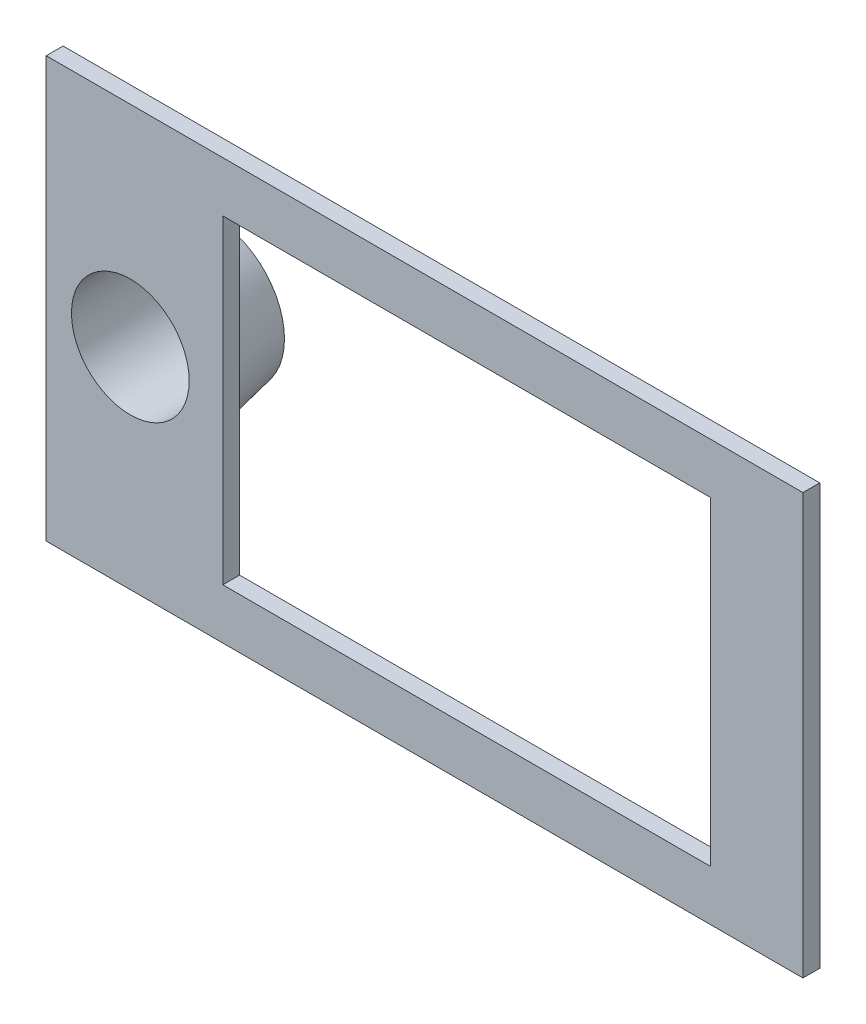
from build123d import *

# Parameters (mm, degrees)
SKETCH_1_W          = 135
SKETCH_1_H          = 75
SKETCH_1_R          = 10.5
SKETCH_1_W_2        = 87
SKETCH_1_H_2        = 57
EXTRUDE_1_DEPTH     = 3
SKETCH_5_R          = 15
SKETCH_4_R          = 12.5
CUT_EXTRUDE_1_REACH = 171.52
SKETCH_5_93_R       = 10.5


with BuildPart() as part:
    # 草图1 → 凸台-拉伸1 (new body)
    with BuildSketch(Plane(origin=(0, 0, 902.944534426), x_dir=(-1, 0, 0), z_dir=(0, 0, -1))):
        with Locations((-85.5, 34.5)):
            Rectangle(SKETCH_1_W, SKETCH_1_H)
        with Locations((-33, 34.5)):
            Circle(SKETCH_1_R, mode=Mode.SUBTRACT)
        with Locations((-93, 34.5)):
            Rectangle(SKETCH_1_W_2, SKETCH_1_H_2, mode=Mode.SUBTRACT)
    extrude(amount=EXTRUDE_1_DEPTH)

    # 草图5 → 放样4 section 0
    with BuildSketch(Plane(origin=(0, 0, 899.944534426), x_dir=(-1, 0, 0), z_dir=(0, 0, -1))):
        with Locations((-33, 34.5)):
            Circle(SKETCH_5_R)
    # 草图4 → 放样4 section 1
    with BuildSketch(Plane.XY.offset(887.944534426)):
        with Locations((33, 34.5)):
            Circle(SKETCH_4_R)
    loft()

    # 草图5<93> → 切除-拉伸1 (cut, up to next)
    with BuildSketch(Plane(origin=(0, 0, 899.944534426), x_dir=(-1, 0, 0), z_dir=(0, 0, -1)), mode=Mode.PRIVATE) as cut_extrude_1_sk1:
        with Locations(Location((-33, 34.5, 0), (0, 0, 180))):
            Circle(SKETCH_5_93_R)
    cut_extrude_1_tool1 = extrude(cut_extrude_1_sk1.sketch, amount=CUT_EXTRUDE_1_REACH, mode=Mode.PRIVATE) & part.part
    add(cut_extrude_1_tool1.solids().sort_by_distance((33, 34.5, 899.944534))[0], mode=Mode.SUBTRACT)


solid = part.part
